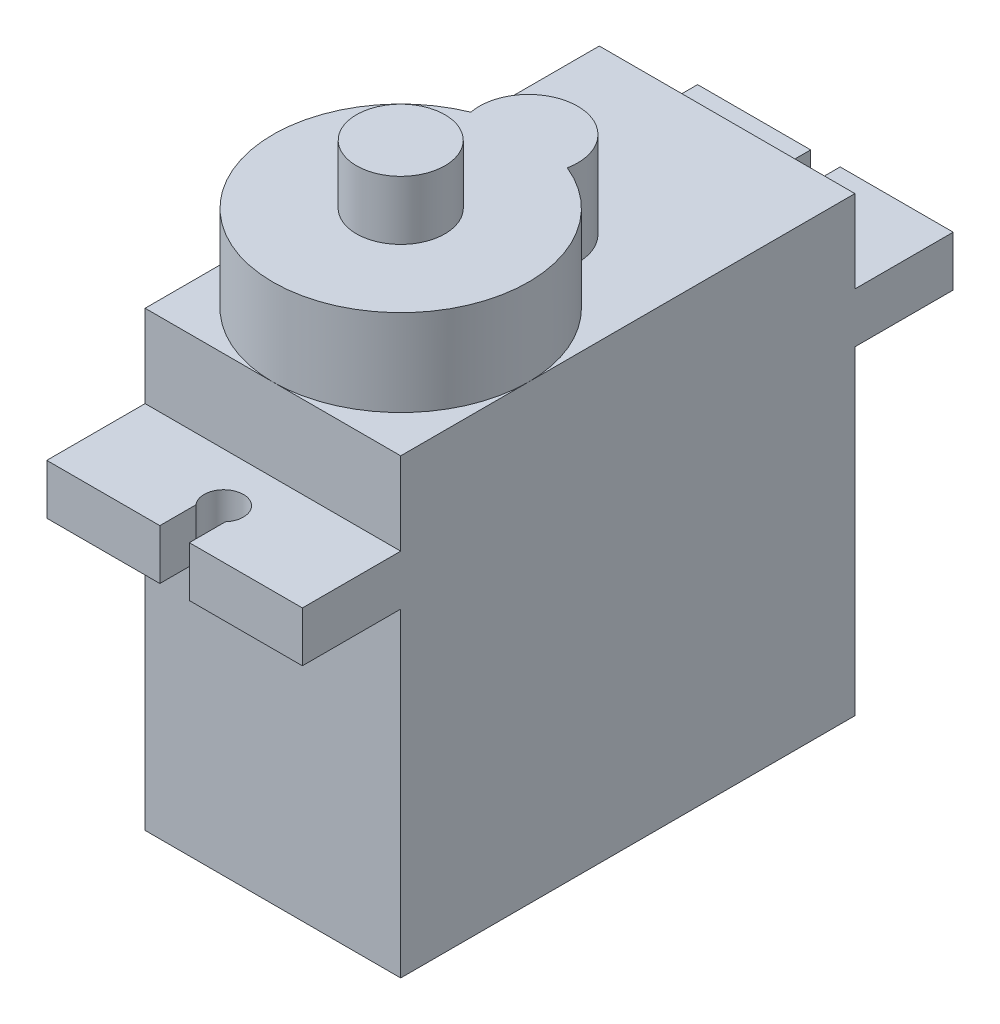
from build123d import *

# Parameters (mm, degrees)
BOSS_EXTRUDE1_DEPTH = 13
BOSS_EXTRUDE2_DEPTH = 4.4
SKETCH3_R           = 2.25
BOSS_EXTRUDE3_DEPTH = 3
CUT_EXTRUDE1_REACH  = 30.22


with BuildPart() as part:
    # Sketch1 → Boss-Extrude1 (new body)
    with BuildSketch(Plane(origin=(0, 0, 0), x_dir=(0, 0, -1), z_dir=(1, 0, 0))):
        Polygon((11.55, -4.2), (16.55, -4.2), (16.55, -6.75), (11.55, -6.75), (11.55, -23), (-11.55, -23), (-11.55, -6.75), (-16.55, -6.75), (-16.55, -4.2), (-11.55, -4.2), (-11.55, 0), (11.55, 0), align=None)
    extrude(amount=BOSS_EXTRUDE1_DEPTH)

    # Sketch2 → Boss-Extrude2 (add)
    with BuildSketch(Plane(origin=(0, 0, 0), x_dir=(1, 0, 0), z_dir=(0, 1, 0))):
        with BuildLine():
            ThreePointArc((4.046663303, 0.969230769), (6.5, -11.55), (8.953336697, 0.969230769))
            ThreePointArc((8.953336697, 0.969230769), (6.5, 3.95), (4.046663303, 0.969230769))
        make_face()
    extrude(amount=BOSS_EXTRUDE2_DEPTH)

    # Sketch3 → Boss-Extrude3 (add)
    with BuildSketch(Plane(origin=(0, 4.4, 0), x_dir=(1, 0, 0), z_dir=(0, 1, 0))):
        with Locations(Location((6.5, -5.05, 0), (0, 0, 270))):
            Circle(SKETCH3_R)
    extrude(amount=BOSS_EXTRUDE3_DEPTH)

    # Sketch4 → Cut-Extrude1 (cut, up to next)
    with BuildSketch(Plane(origin=(0, -4.2, 0), x_dir=(1, 0, 0), z_dir=(0, 1, 0)), mode=Mode.PRIVATE) as cut_extrude1_sk1:
        with BuildLine():
            Line((5.75, -16.55), (5.75, -14.711437828))
            ThreePointArc((5.75, -14.711437828), (6.5, -13.05), (7.25, -14.711437828))
            Line((7.25, -14.711437828), (7.25, -16.55))
            Line((7.25, -16.55), (5.75, -16.55))
        make_face()
    cut_extrude1_tool1 = extrude(cut_extrude1_sk1.sketch, amount=-CUT_EXTRUDE1_REACH, mode=Mode.PRIVATE) & part.part
    cut_extrude1 = cut_extrude1_tool1.solids().sort_by_distance((6.5, -4.2, 14.785135))[0]
    add(cut_extrude1, mode=Mode.SUBTRACT)

    # Mirror1: Cut-Extrude1 across plane
    add(cut_extrude1.mirror(Plane.XY), mode=Mode.SUBTRACT)


solid = part.part
